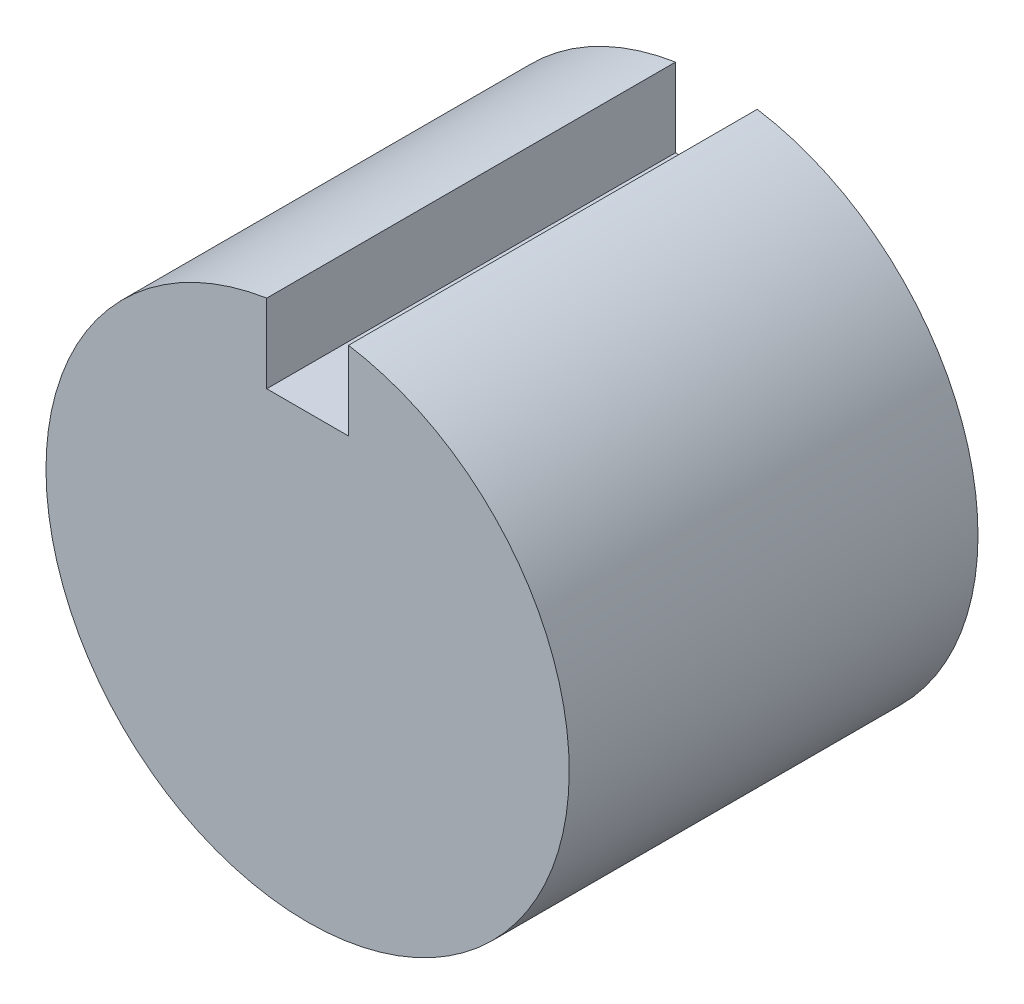
from build123d import *

# Parameters (mm, degrees)
IZIM1_R                     = 6.4
Y_KSEKLIK_EKSTR_ZYON1_DEPTH = 10
KES_EKSTR_ZYON1_DEPTH       = 14.48777224
KES_EKSTR_ZYON1_DEPTH_BACK  = 10


with BuildPart() as part:
    # Çizim1 → Yükseklik-Ekstrüzyon1 (new body)
    with BuildSketch(Plane.XY):
        Circle(IZIM1_R)
    extrude(amount=Y_KSEKLIK_EKSTR_ZYON1_DEPTH)

    # Çizim2 → Kes-Ekstrüzyon1 (cut, two sides: drawn at the far end of the back side and taken through both)
    with BuildSketch(Plane(origin=(0, 0, 0), x_dir=(-1, 0, 0), z_dir=(0, 0, -1)).offset(-KES_EKSTR_ZYON1_DEPTH_BACK)):
        with BuildLine():
            Line((-1, 4.4), (1, 4.4))
            Line((1, 4.4), (1, 6.321392252))
            ThreePointArc((1, 6.321392252), (0, 6.4), (-1, 6.321392252))
            Line((-1, 6.321392252), (-1, 4.4))
        make_face()
    extrude(amount=KES_EKSTR_ZYON1_DEPTH + KES_EKSTR_ZYON1_DEPTH_BACK, mode=Mode.SUBTRACT)


solid = part.part
